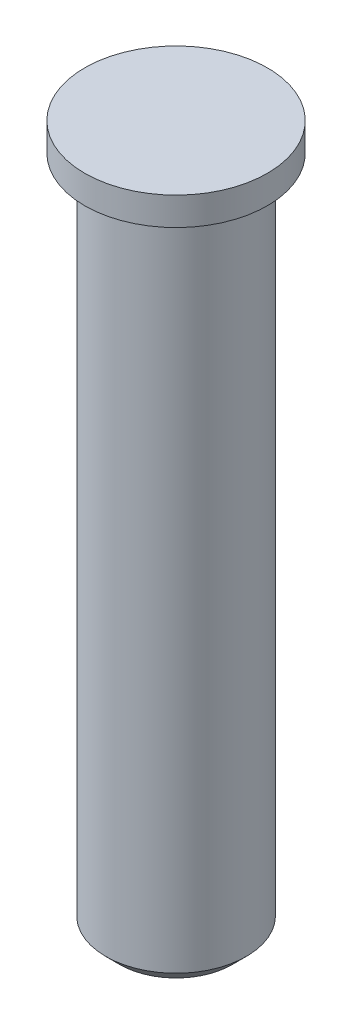
from build123d import *

# Parameters (mm, degrees)
CHAFL_N1_SIZE = 0.5


with BuildPart() as part:
    # Croquis1 → Revolución1 (revolve)
    with BuildSketch(Plane.XY, mode=Mode.PRIVATE) as revoluci_n1_sk:
        Polygon((0, 0), (3.25, 0), (3.25, -1), (2.5, -1), (2.5, -25), (0, -25), align=None)
    revolve(revoluci_n1_sk.sketch.rotate(Axis((0, 0, 0), (0, -1, 0)), 90), axis=Axis((0, 0, 0), (0, -1, 0)))

    # Chaflán1
    chafl_n1_edges = [part.edges().sort_by_distance(p)[0] for p in [
        (0, -25, -2.5),
    ]]
    chamfer(chafl_n1_edges, length=CHAFL_N1_SIZE)


solid = part.part
